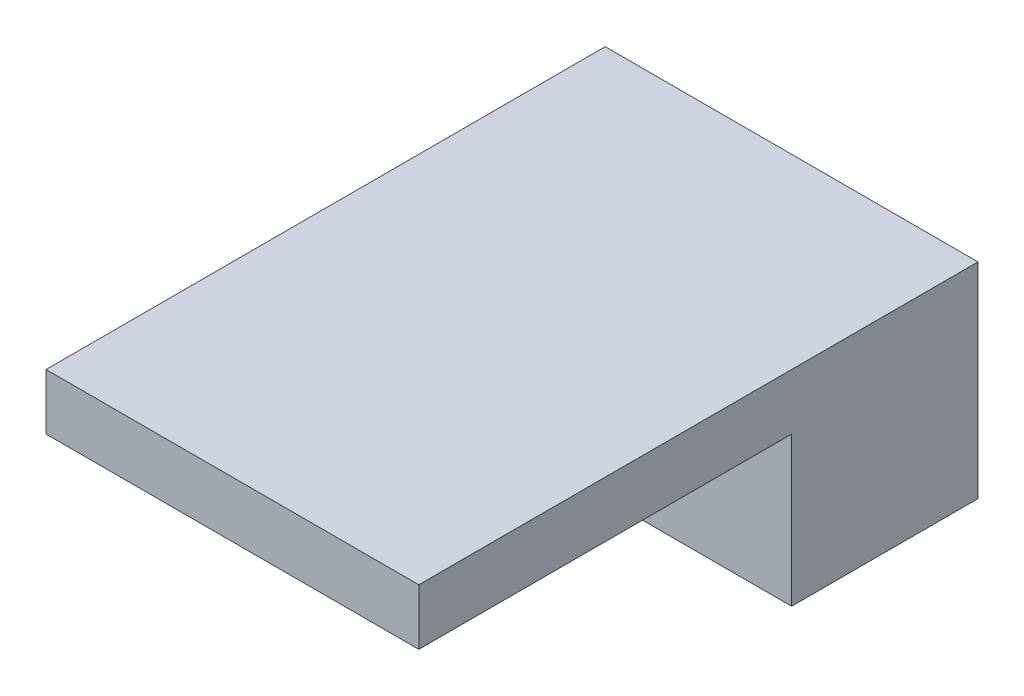
from build123d import *

# Parameters (mm, degrees)
SKETCH_1_W      = 20
SKETCH_1_H      = 30
EXTRUDE_1_DEPTH = 3
SKETCH_4_W      = 20
SKETCH_4_H      = 10
EXTRUDE_2_DEPTH = 8


with BuildPart() as part:
    # 草图1 → 凸台-拉伸1 (new body)
    with BuildSketch(Plane(origin=(0, 0, 0), x_dir=(1, 0, 0), z_dir=(0, 1, 0))):
        with Locations((10, -15)):
            Rectangle(SKETCH_1_W, SKETCH_1_H)
    extrude(amount=EXTRUDE_1_DEPTH)

    # 草图4 → 凸台-拉伸2 (add)
    with BuildSketch(Plane.XZ):
        with Locations((10, 5)):
            Rectangle(SKETCH_4_W, SKETCH_4_H)
    extrude(amount=EXTRUDE_2_DEPTH)


solid = part.part
